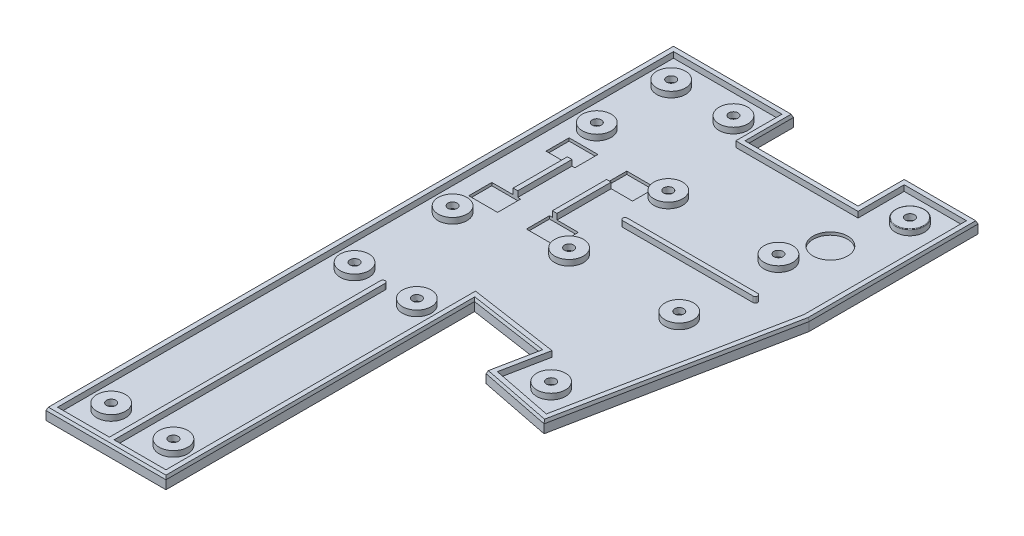
from build123d import *

# Parameters (mm, degrees)
BOSS_EXTRUDE1_DEPTH             = 0.5
BOSS_EXTRUDE1_DRAFT             = 21.801409486
BOSS_EXTRUDE2_DEPTH             = 1.5
CUT_EXTRUDE1_DEPTH              = 1
SKETCH4_W                       = 5
SKETCH4_H                       = 4
CUT_EXTRUDE2_DEPTH              = 0.5
SKETCH5_W                       = 0.8
SKETCH5_H                       = 9.4
BOSS_EXTRUDE3_DEPTH             = 1
SKETCH6_W                       = 5
SKETCH6_H                       = 4
CUT_EXTRUDE3_DEPTH              = 0.5
SKETCH7_W                       = 5
SKETCH7_H                       = 4
CUT_EXTRUDE4_DEPTH              = 0.5
SKETCH8_W                       = 0.8
SKETCH8_H                       = 9.4
BOSS_EXTRUDE4_DEPTH             = 1
SKETCH9_W                       = 5
SKETCH9_H                       = 4
CUT_EXTRUDE5_DEPTH              = 0.5
BOSS_EXTRUDE5_DEPTH             = 1
BOSS_EXTRUDE6_DEPTH             = 1
DRAFT1_ANGLE                    = -8.423132134
SKETCH12_W                      = 2.5
SKETCH12_H                      = 1
SKETCH13_W                      = 2.5
SKETCH13_H                      = 1
SKETCH14_W                      = 2.5
SKETCH14_H                      = 1
SKETCH15_W                      = 2.5
SKETCH15_H                      = 1
SKETCH16_W                      = 2.5
SKETCH16_H                      = 1
SKETCH17_W                      = 2.5
SKETCH17_H                      = 1
SKETCH18_W                      = 2.5
SKETCH18_H                      = 1
SKETCH19_W                      = 2.5
SKETCH19_H                      = 1
SKETCH20_W                      = 2.5
SKETCH20_H                      = 1
SKETCH21_W                      = 2.5
SKETCH21_H                      = 1
SKETCH22_W                      = 2.5
SKETCH22_H                      = 1
SKETCH23_W                      = 2.5
SKETCH23_H                      = 1
SKETCH24_W                      = 2.5
SKETCH24_H                      = 1
SKETCH25_W                      = 2.5
SKETCH25_H                      = 1
M3X0_5_TAPPED_HOLE1_D           = 1.6
M3X0_5_TAPPED_HOLE1_CBORE_D     = 3
M3X0_5_TAPPED_HOLE1_CBORE_DEPTH = 1
F_6_0_6_DIAMETER_HOLE1_D        = 6
F_6_0_6_DIAMETER_HOLE1_DEPTH    = 0.5
FILLET2_R                       = 0.1


with BuildPart() as part:
    # Sketch1 → Boss-Extrude1 (with draft: the straight prism first)
    with BuildSketch(Plane(origin=(0, 2, 0), x_dir=(1, 0, 0), z_dir=(0, 1, 0))):
        Polygon((24.217912597, -38.196520554), (31.8, -0.078793123), (31.8, 28.981304325), (19.4, 28.981304325), (19.4, 20.981304325), (-0.2, 20.981304325), (-0.2, 28.981304325), (-20.6, 28.981304325), (-20.6, -79.418695675), (-0.2, -79.418695675), (-0.2, -25.874898862), (13.618871878, -27.92119344), (12.05617512, -35.777400561), align=None)
    extrude(amount=-BOSS_EXTRUDE1_DEPTH)
    # Boss-Extrude1: the draft: its side faces are tilted about the plane it starts from
    boss_extrude1_sides = [part.faces().sort_by_distance(p)[0] for p in [
        (28.008956299, 1.75, 19.137656838),
        (31.8, 1.75, -14.451255601),
        (25.6, 1.75, -28.981304325),
        (19.4, 1.75, -24.981304325),
        (9.6, 1.75, -20.981304325),
        (-0.2, 1.75, -24.981304325),
        (-10.4, 1.75, -28.981304325),
        (-20.6, 1.75, 25.218695675),
        (-10.4, 1.75, 79.418695675),
        (-0.2, 1.75, 52.646797268),
        (6.709435939, 1.75, 26.898046151),
        (12.837523499, 1.75, 31.849297001),
        (18.137043859, 1.75, 36.986960558),
    ]]
    draft(boss_extrude1_sides, Plane(origin=(0, 2, 0), x_dir=(1, 0, 0), z_dir=(0, 1, 0)), BOSS_EXTRUDE1_DRAFT)

    # Sketch2 → Boss-Extrude2 (add)
    with BuildSketch(Plane.XZ.offset(-1.5)):
        Polygon((32, -29.181304325), (19.2, -29.181304325), (19.2, -21.181304325), (0, -21.181304325), (0, -29.181304325), (-20.8, -29.181304325), (-20.8, 79.618695675), (0, 79.618695675), (0, 26.106695675), (13.381722576, 28.08825731), (11.821, 35.934539553), (24.375051589, 38.431695675), (32, 0.098491403), align=None)
    extrude(amount=BOSS_EXTRUDE2_DEPTH)

    # Sketch3 → Cut-Extrude1 (cut)
    with BuildSketch(Plane(origin=(0, 2, 0), x_dir=(-1, 0, 0), z_dir=(0, 1, 0))):
        Polygon((19.8, -28.181304325), (19.8, 78.618695675), (1, 78.618695675), (1, 24.947711614), (-15.026007114, 24.947711614), (-12.996875602, 35.148844594), (-23.589356631, 37.255820072), (-31, 0), (-31, -28.181304325), (-20.2, -28.181304325), (-20.2, -20.181304325), (1, -20.181304325), (1, -28.181304325), align=None)
    extrude(amount=-CUT_EXTRUDE1_DEPTH, mode=Mode.SUBTRACT)

    # Sketch4 → Cut-Extrude2 (cut)
    with BuildSketch(Plane(origin=(0, 1, 0), x_dir=(-1, 0, 0), z_dir=(0, 1, 0))):
        with Locations((4.4, 8.218695675)):
            Rectangle(SKETCH4_W, SKETCH4_H)
    extrude(amount=-CUT_EXTRUDE2_DEPTH, mode=Mode.SUBTRACT)

    # Sketch5 → Boss-Extrude3 (add)
    with BuildSketch(Plane(origin=(0, 1, 0), x_dir=(-1, 0, 0), z_dir=(0, 1, 0))):
        with Locations((6, 1.518695675)):
            Rectangle(SKETCH5_W, SKETCH5_H)
    extrude(amount=BOSS_EXTRUDE3_DEPTH)

    # Sketch6 → Cut-Extrude3 (cut)
    with BuildSketch(Plane(origin=(0, 1, 0), x_dir=(-1, 0, 0), z_dir=(0, 1, 0))):
        with Locations((4.4, -5.181304325)):
            Rectangle(SKETCH6_W, SKETCH6_H)
    extrude(amount=-CUT_EXTRUDE3_DEPTH, mode=Mode.SUBTRACT)

    # Sketch7 → Cut-Extrude4 (cut)
    with BuildSketch(Plane(origin=(0, 1, 0), x_dir=(-1, 0, 0), z_dir=(0, 1, 0))):
        with Locations((14.4, 8.218695675)):
            Rectangle(SKETCH7_W, SKETCH7_H)
    extrude(amount=-CUT_EXTRUDE4_DEPTH, mode=Mode.SUBTRACT)

    # Sketch8 → Boss-Extrude4 (add)
    with BuildSketch(Plane(origin=(0, 1, 0), x_dir=(-1, 0, 0), z_dir=(0, 1, 0))):
        with Locations((12.8, 1.518695675)):
            Rectangle(SKETCH8_W, SKETCH8_H)
    extrude(amount=BOSS_EXTRUDE4_DEPTH)

    # Sketch9 → Cut-Extrude5 (cut)
    with BuildSketch(Plane(origin=(0, 1, 0), x_dir=(-1, 0, 0), z_dir=(0, 1, 0))):
        with Locations((14.4, -5.181304325)):
            Rectangle(SKETCH9_W, SKETCH9_H)
    extrude(amount=-CUT_EXTRUDE5_DEPTH, mode=Mode.SUBTRACT)

    # Sketch10 → Boss-Extrude5 (add)
    with BuildSketch(Plane(origin=(0, 1, 0), x_dir=(-1, 0, 0), z_dir=(0, 1, 0))):
        with BuildLine():
            Line((10.8, 78.618695675), (10.8, 31.618695675))
            ThreePointArc((10.8, 31.618695675), (10.4, 31.218695675), (10, 31.618695675))
            Line((10, 31.618695675), (10, 78.618695675))
            Line((10, 78.618695675), (10.8, 78.618695675))
        make_face()
    extrude(amount=BOSS_EXTRUDE5_DEPTH)

    # Sketch11 → Boss-Extrude6 (add)
    with BuildSketch(Plane(origin=(0, 1, 0), x_dir=(-1, 0, 0), z_dir=(0, 1, 0))):
        with BuildLine():
            Line((-1.2, 0.818695675), (-23.8, 0.818695675))
            ThreePointArc((-23.8, 0.818695675), (-24.2, 1.218695675), (-23.8, 1.618695675))
            Line((-23.8, 1.618695675), (-1.2, 1.618695675))
            ThreePointArc((-1.2, 1.618695675), (-0.8, 1.218695675), (-1.2, 0.818695675))
        make_face()
    extrude(amount=BOSS_EXTRUDE6_DEPTH)

    # Draft1
    draft1_faces = [part.faces().sort_by_distance(p)[0] for p in [
        (7.013003557, 1.5, 24.947711614),
    ]]
    draft(draft1_faces, Plane(origin=(-1, 1, 78.618695675), x_dir=(0, 0, -1), z_dir=(-1, 0, 0)), DRAFT1_ANGLE)

    # Sketch12 → Revolve1 (revolve)
    with BuildSketch(Plane.XY.offset(-6.881304325)):
        with Locations((1.85, 1.5)):
            Rectangle(SKETCH12_W, SKETCH12_H)
    revolve(axis=Axis((0.6, 2, -6.881304325), (0, -1, 0)))

    # Sketch13 → Revolve2 (revolve)
    with BuildSketch(Plane.XY.offset(73.318695675), mode=Mode.PRIVATE) as revolve2_sk:
        with Locations((-14.55, 1.5)):
            Rectangle(SKETCH13_W, SKETCH13_H)
    revolve(revolve2_sk.sketch.rotate(Axis((-15.8, 2, 73.318695675), (0, -1, 0)), 270), axis=Axis((-15.8, 2, 73.318695675), (0, -1, 0)))

    # Sketch14 → Revolve3 (revolve)
    with BuildSketch(Plane.XY.offset(73.318695675), mode=Mode.PRIVATE) as revolve3_sk:
        with Locations((-3.75, 1.5)):
            Rectangle(SKETCH14_W, SKETCH14_H)
    revolve(revolve3_sk.sketch.rotate(Axis((-5, 2, 73.318695675), (0, -1, 0)), 270), axis=Axis((-5, 2, 73.318695675), (0, -1, 0)))

    # Sketch15 → Revolve4 (revolve)
    with BuildSketch(Plane.XY.offset(31.118695675), mode=Mode.PRIVATE) as revolve4_sk:
        with Locations((-14.55, 1.5)):
            Rectangle(SKETCH15_W, SKETCH15_H)
    revolve(revolve4_sk.sketch.rotate(Axis((-15.8, 2, 31.118695675), (0, -1, 0)), 270), axis=Axis((-15.8, 2, 31.118695675), (0, -1, 0)))

    # Sketch16 → Revolve5 (revolve)
    with BuildSketch(Plane.XY.offset(31.118695675), mode=Mode.PRIVATE) as revolve5_sk:
        with Locations((-3.75, 1.5)):
            Rectangle(SKETCH16_W, SKETCH16_H)
    revolve(revolve5_sk.sketch.rotate(Axis((-5, 2, 31.118695675), (0, -1, 0)), 270), axis=Axis((-5, 2, 31.118695675), (0, -1, 0)))

    # Sketch17 → Revolve6 (revolve)
    with BuildSketch(Plane.XY.offset(14.118695675), mode=Mode.PRIVATE) as revolve6_sk:
        with Locations((-14.55, 1.5)):
            Rectangle(SKETCH17_W, SKETCH17_H)
    revolve(revolve6_sk.sketch.rotate(Axis((-15.8, 2, 14.118695675), (0, -1, 0)), 270), axis=Axis((-15.8, 2, 14.118695675), (0, -1, 0)))

    # Sketch18 → Revolve7 (revolve)
    with BuildSketch(Plane.XY.offset(-10.881304325), mode=Mode.PRIVATE) as revolve7_sk:
        with Locations((-14.55, 1.5)):
            Rectangle(SKETCH18_W, SKETCH18_H)
    revolve(revolve7_sk.sketch.rotate(Axis((-15.8, 2, -10.881304325), (0, -1, 0)), 270), axis=Axis((-15.8, 2, -10.881304325), (0, -1, 0)))

    # Sketch19 → Revolve8 (revolve)
    with BuildSketch(Plane.XY.offset(-23.781304325), mode=Mode.PRIVATE) as revolve8_sk:
        with Locations((-14.55, 1.5)):
            Rectangle(SKETCH19_W, SKETCH19_H)
    revolve(revolve8_sk.sketch.rotate(Axis((-15.8, 2, -23.781304325), (0, -1, 0)), 270), axis=Axis((-15.8, 2, -23.781304325), (0, -1, 0)))

    # Sketch20 → Revolve9 (revolve)
    with BuildSketch(Plane.XY.offset(-23.781304325), mode=Mode.PRIVATE) as revolve9_sk:
        with Locations((-3.75, 1.5)):
            Rectangle(SKETCH20_W, SKETCH20_H)
    revolve(revolve9_sk.sketch.rotate(Axis((-5, 2, -23.781304325), (0, -1, 0)), 270), axis=Axis((-5, 2, -23.781304325), (0, -1, 0)))

    # Sketch21 → Revolve10 (revolve)
    with BuildSketch(Plane.XY.offset(-23.781304325)):
        with Locations((26.85, 1.5)):
            Rectangle(SKETCH21_W, SKETCH21_H)
    revolve(axis=Axis((25.6, 2, -23.781304325), (0, -1, 0)))

    # Sketch22 → Revolve11 (revolve)
    with BuildSketch(Plane.XY.offset(-6.881304325), mode=Mode.PRIVATE) as revolve11_sk:
        with Locations((20.95, 1.5)):
            Rectangle(SKETCH22_W, SKETCH22_H)
    revolve(revolve11_sk.sketch.rotate(Axis((19.7, 2, -6.881304325), (0, -1, 0)), 270), axis=Axis((19.7, 2, -6.881304325), (0, -1, 0)))

    # Sketch23 → Revolve12 (revolve)
    with BuildSketch(Plane.XY.offset(10.318695675), mode=Mode.PRIVATE) as revolve12_sk:
        with Locations((20.95, 1.5)):
            Rectangle(SKETCH23_W, SKETCH23_H)
    revolve(revolve12_sk.sketch.rotate(Axis((19.7, 2, 10.318695675), (0, -1, 0)), 270), axis=Axis((19.7, 2, 10.318695675), (0, -1, 0)))

    # Sketch24 → Revolve13 (revolve)
    with BuildSketch(Plane.XY.offset(31.972205419), mode=Mode.PRIVATE) as revolve13_sk:
        with Locations((20.384540675, 1.5)):
            Rectangle(SKETCH24_W, SKETCH24_H)
    revolve(revolve13_sk.sketch.rotate(Axis((19.134540675, 2, 31.972205419), (0, -1, 0)), 270), axis=Axis((19.134540675, 2, 31.972205419), (0, -1, 0)))

    # Sketch25 → Revolve14 (revolve)
    with BuildSketch(Plane.XY.offset(10.318695675)):
        with Locations((1.85, 1.5)):
            Rectangle(SKETCH25_W, SKETCH25_H)
    revolve(axis=Axis((0.6, 2, 10.318695675), (0, -1, 0)))

    # M3x0.5 Tapped Hole1 (through all)
    with Locations(Plane(origin=(0, 0, 0), x_dir=(-1, 0, 0), z_dir=(0, -1, 0))):
        with Locations((15.8, 10.881304325), (5, 23.781304325), (-19.7, 6.881304325), (-19.134540675, -31.972205419), (15.8, -14.118695675), (15.8, -31.118695675), (15.8, -73.318695675), (5, -73.318695675), (5, -31.118695675), (-0.6, -10.318695675), (-19.7, -10.318695675), (-25.6, 23.781304325), (15.8, 23.781304325), (-0.6, 6.881304325)):
            CounterBoreHole(M3X0_5_TAPPED_HOLE1_D / 2, M3X0_5_TAPPED_HOLE1_CBORE_D / 2, M3X0_5_TAPPED_HOLE1_CBORE_DEPTH)

    # Ø6.0 (6) Diameter Hole1
    with Locations(Plane(origin=(0, 1, 0), x_dir=(1, 0, 0), z_dir=(0, 1, 0))):
        with Locations((22, 13.581304325)):
            Hole(F_6_0_6_DIAMETER_HOLE1_D / 2, depth=F_6_0_6_DIAMETER_HOLE1_DEPTH)

    # Fillet2
    fillet2_edges = [part.edges().sort_by_distance(p)[0] for p in [
        (23.1, 2, -23.781304325),
    ]]
    fillet(fillet2_edges, radius=FILLET2_R)


solid = part.part
